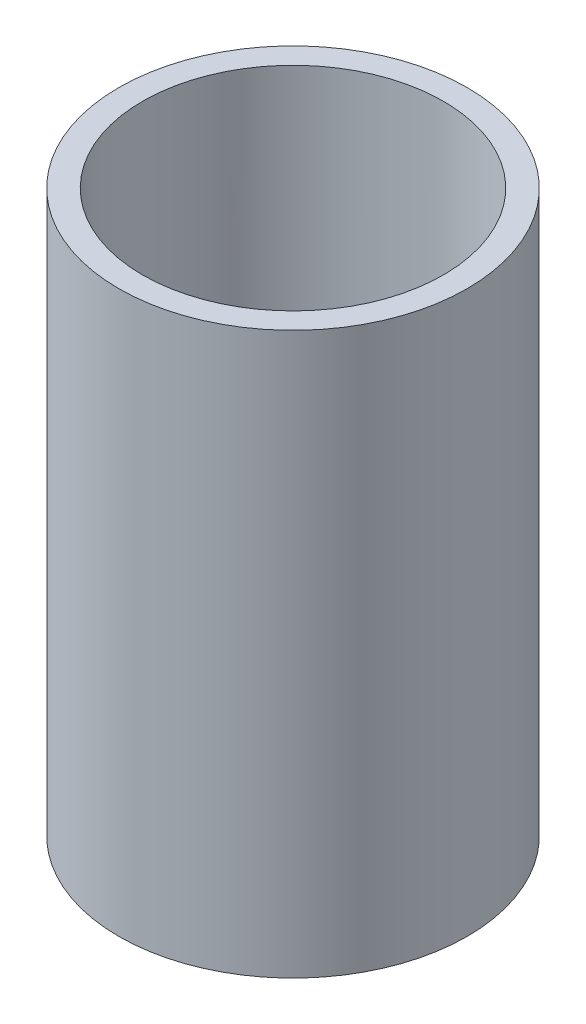
from build123d import *

# Parameters (mm, degrees)
SKETCH1_R                       = 18.35
BOSS_EXTRUDE1_DEPTH             = 59.1
SKETCH2_R                       = 15.85
CUT_EXTRUDE1_DEPTH              = 57.1
BOSS_EXTRUDE2_REACH             = 66.547
BOSS_EXTRUDE2_DIRECTION_2_REACH = 66.547


with BuildPart() as part:
    # Sketch1 → Boss-Extrude1 (new body)
    with BuildSketch(Plane(origin=(0, 0, 0), x_dir=(1, 0, 0), z_dir=(0, 1, 0))):
        with Locations(Location((0, 0, 0), (0, 0, 270))):
            Circle(SKETCH1_R)
    extrude(amount=BOSS_EXTRUDE1_DEPTH)

    # Sketch2 → Cut-Extrude1 (cut)
    with BuildSketch(Plane(origin=(0, 59.1, 0), x_dir=(1, 0, 0), z_dir=(0, 1, 0))):
        with Locations(Location((0, 0, 0), (0, 0, 270))):
            Circle(SKETCH2_R)
    extrude(amount=-CUT_EXTRUDE1_DEPTH, mode=Mode.SUBTRACT)

    # Sketch3 → Boss-Extrude2 (add, up to next)
    with BuildSketch(Plane.XY, mode=Mode.PRIVATE) as boss_extrude2_sk1:
        Polygon((-15.85, 33.7), (15.85, 2), (-15.85, 2), align=None)
    boss_extrude2_tool1 = extrude(boss_extrude2_sk1.sketch, amount=BOSS_EXTRUDE2_REACH, mode=Mode.PRIVATE) - part.part
    add(boss_extrude2_tool1.solids().sort_by_distance((-5.283333, 12.566667, 0))[0])

    # Sketch3 → Boss-Extrude2 direction 2 (add, up to next)
    with BuildSketch(Plane.XY, mode=Mode.PRIVATE) as boss_extrude2_direction_2_sk1:
        Polygon((-15.85, 33.7), (15.85, 2), (-15.85, 2), align=None)
    boss_extrude2_direction_2_tool1 = extrude(boss_extrude2_direction_2_sk1.sketch, amount=-BOSS_EXTRUDE2_DIRECTION_2_REACH, mode=Mode.PRIVATE) - part.part
    add(boss_extrude2_direction_2_tool1.solids().sort_by_distance((-5.283333, 12.566667, 0))[0])


solid = part.part
